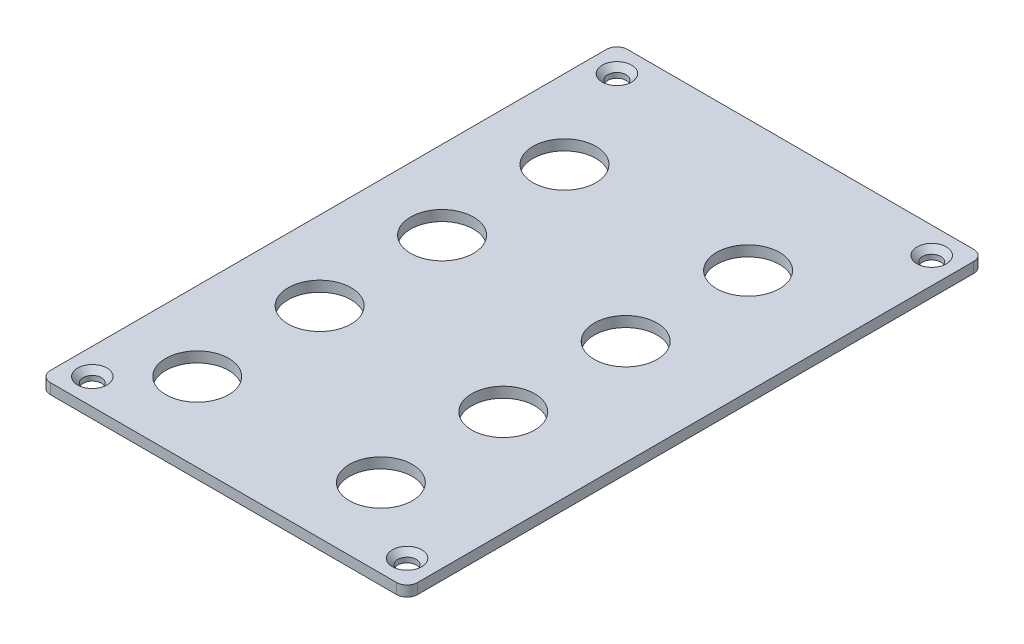
from build123d import *

# Parameters (mm, degrees)
FACE_PLATE_W           = 70
FACE_PLATE_H           = 110
FACE_PLATE_EXT_DEPTH   = 2
BUTTONS_R              = 6
BUTTONS_CUT_DEPTH      = 10
M3_TOP_SCREW_R         = 1.75
M3_TOP_SCREW_CUT_DEPTH = 10
FILLET1_R              = 2
FILLET2_R              = 2
FILLET3_R              = 2
FILLET4_R              = 2


with BuildPart() as part:
    # Face Plate → Face Plate Ext (new body)
    with BuildSketch(Plane(origin=(0, 0, 0), x_dir=(1, 0, 0), z_dir=(0, 1, 0))):
        Rectangle(FACE_PLATE_W, FACE_PLATE_H)
    extrude(amount=FACE_PLATE_EXT_DEPTH)

    # Buttons → Buttons CUT (cut)
    with BuildSketch(Plane(origin=(0, 2, 0), x_dir=(1, 0, 0), z_dir=(0, 1, 0))):
        with Locations(Location((-20, 30, 0), (0, 0, 270))):
            Circle(BUTTONS_R)
        with Locations(Location((15, 30, 0), (0, 0, 270))):
            Circle(BUTTONS_R)
        with Locations(Location((-20, 6.666666667, 0), (0, 0, 270))):
            Circle(BUTTONS_R)
        with Locations(Location((15, 6.666666667, 0), (0, 0, 270))):
            Circle(BUTTONS_R)
        with Locations(Location((-20, -16.666666667, 0), (0, 0, 270))):
            Circle(BUTTONS_R)
        with Locations(Location((-20, -40, 0), (0, 0, 270))):
            Circle(BUTTONS_R)
        with Locations(Location((15, -16.666666667, 0), (0, 0, 270))):
            Circle(BUTTONS_R)
        with Locations(Location((15, -40, 0), (0, 0, 270))):
            Circle(BUTTONS_R)
    extrude(amount=-BUTTONS_CUT_DEPTH, mode=Mode.SUBTRACT)

    # M3 Top Screw → M3 Top Screw CUT (cut)
    with BuildSketch(Plane(origin=(0, 2, 0), x_dir=(1, 0, 0), z_dir=(0, 1, 0))):
        with Locations(Location((-30, 50, 0), (0, 0, 270))):
            Circle(M3_TOP_SCREW_R)
        with Locations(Location((30, 50, 0), (0, 0, 270))):
            Circle(M3_TOP_SCREW_R)
        with Locations(Location((-30, -50, 0), (0, 0, 270))):
            Circle(M3_TOP_SCREW_R)
        with Locations(Location((30, -50, 0), (0, 0, 270))):
            Circle(M3_TOP_SCREW_R)
    extrude(amount=-M3_TOP_SCREW_CUT_DEPTH, mode=Mode.SUBTRACT)

    # M3 Head Top CUT cone 1 section (through the dimple's axis) → M3 Head Top CUT (revolve, cut)
    with BuildSketch(Plane(origin=(-30, 2, -50), x_dir=(0, 0, 1), z_dir=(1, 0, 0))):
        Polygon((0, 0), (2.8, 0), (0, 2.8), align=None)
    revolve(axis=Axis((-30, 2, -50), (0, -1, 0)), mode=Mode.SUBTRACT)

    # M3 Head Top CUT cone 2 section (through the dimple's axis) → M3 Head Top CUT cone 2 (revolve, cut)
    with BuildSketch(Plane(origin=(30, 2, -50), x_dir=(0, 0, 1), z_dir=(1, 0, 0))):
        Polygon((0, 0), (2.8, 0), (0, 2.8), align=None)
    revolve(axis=Axis((30, 2, -50), (0, -1, 0)), mode=Mode.SUBTRACT)

    # M3 Head Top CUT cone 3 section (through the dimple's axis) → M3 Head Top CUT cone 3 (revolve, cut)
    with BuildSketch(Plane(origin=(30, 2, 50), x_dir=(0, 0, 1), z_dir=(1, 0, 0))):
        Polygon((0, 0), (2.8, 0), (0, 2.8), align=None)
    revolve(axis=Axis((30, 2, 50), (0, -1, 0)), mode=Mode.SUBTRACT)

    # M3 Head Top CUT cone 4 section (through the dimple's axis) → M3 Head Top CUT cone 4 (revolve, cut)
    with BuildSketch(Plane(origin=(-30, 2, 50), x_dir=(0, 0, 1), z_dir=(1, 0, 0))):
        Polygon((0, 0), (2.8, 0), (0, 2.8), align=None)
    revolve(axis=Axis((-30, 2, 50), (0, -1, 0)), mode=Mode.SUBTRACT)

    # Fillet1
    fillet1_edges = [part.edges().sort_by_distance(p)[0] for p in [
        (-35, 1, -55),
    ]]
    fillet(fillet1_edges, radius=FILLET1_R)

    # Fillet2
    fillet2_edges = [part.edges().sort_by_distance(p)[0] for p in [
        (35, 1, -55),
    ]]
    fillet(fillet2_edges, radius=FILLET2_R)

    # Fillet3
    fillet3_edges = [part.edges().sort_by_distance(p)[0] for p in [
        (35, 1, 55),
    ]]
    fillet(fillet3_edges, radius=FILLET3_R)

    # Fillet4
    fillet4_edges = [part.edges().sort_by_distance(p)[0] for p in [
        (-35, 1, 55),
    ]]
    fillet(fillet4_edges, radius=FILLET4_R)


solid = part.part
